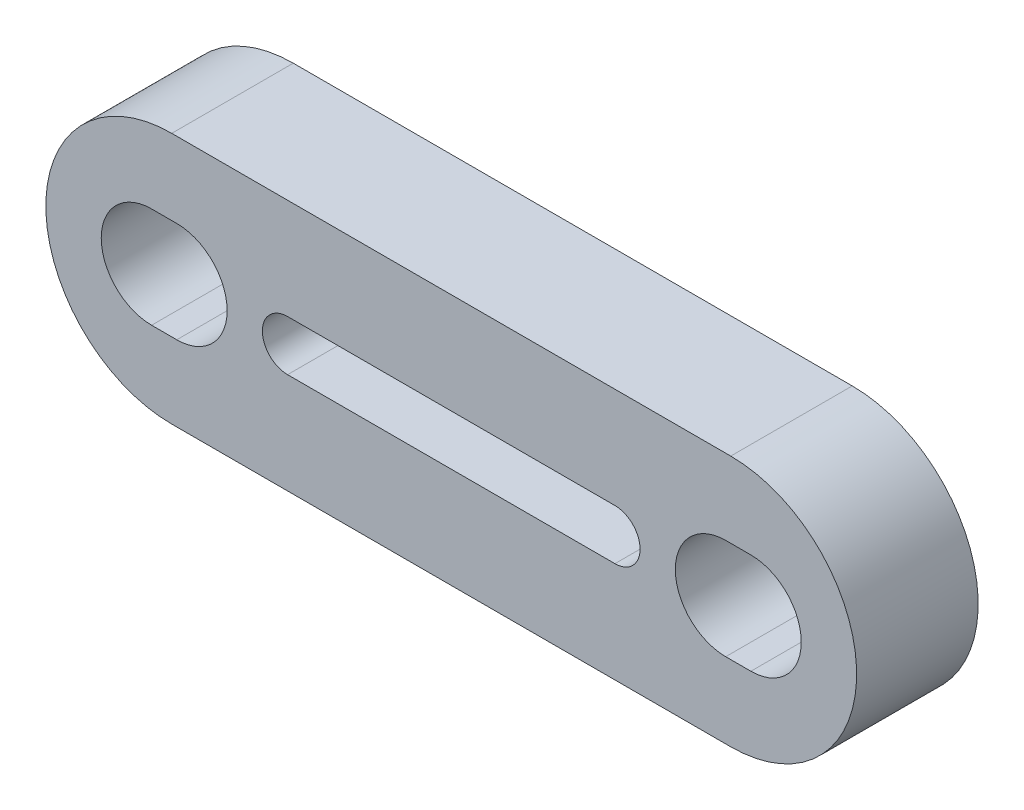
from build123d import *

# Parameters (mm, degrees)
BOSS_EXTRUDE1_DEPTH      = 3.175
BOSS_EXTRUDE1_DEPTH_BACK = 1.651


with BuildPart() as part:
    # Sketch1 → Boss-Extrude1 (new, two sides: drawn at the far end of the back side and taken through both)
    with BuildSketch(Plane.XY.offset(-BOSS_EXTRUDE1_DEPTH_BACK)):
        with BuildLine():
            Line((0.8, 5), (23, 5))
            ThreePointArc((23, 5), (28, 0), (23, -5))
            Line((23, -5), (0.8, -5))
            ThreePointArc((0.8, -5), (-4.2, 0), (0.8, 5))
        make_face()
        with BuildLine():
            Line((0, 2), (1, 2))
            ThreePointArc((1, 2), (3, 0), (1, -2))
            Line((1, -2), (0, -2))
            ThreePointArc((0, -2), (-2, 0), (0, 2))
        make_face(mode=Mode.SUBTRACT)
        with BuildLine():
            Line((22.8, 2), (23.8, 2))
            ThreePointArc((23.8, 2), (25.8, 0), (23.8, -2))
            Line((23.8, -2), (22.8, -2))
            ThreePointArc((22.8, -2), (20.8, 0), (22.8, 2))
        make_face(mode=Mode.SUBTRACT)
        with BuildLine():
            Line((18.4, -1), (5.4, -1))
            ThreePointArc((5.4, -1), (4.4, 0), (5.4, 1))
            Line((5.4, 1), (18.4, 1))
            ThreePointArc((18.4, 1), (19.4, 0), (18.4, -1))
        make_face(mode=Mode.SUBTRACT)
    extrude(amount=BOSS_EXTRUDE1_DEPTH + BOSS_EXTRUDE1_DEPTH_BACK)


solid = part.part
